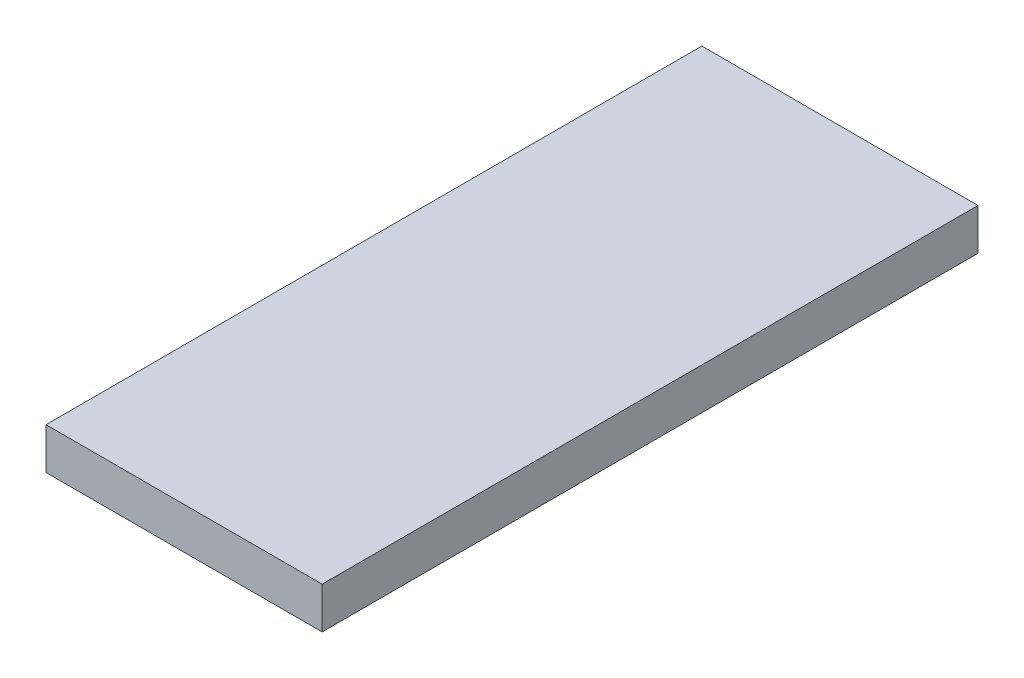
from build123d import *

# Parameters (mm, degrees)
SKETCH1_W           = 16
SKETCH1_H           = 38
BOSS_EXTRUDE1_DEPTH = 2.4


with BuildPart() as part:
    # Sketch1 → Boss-Extrude1 (new body)
    with BuildSketch(Plane(origin=(0, 0, 0), x_dir=(1, 0, 0), z_dir=(0, 1, 0))):
        with Locations((8, 19)):
            Rectangle(SKETCH1_W, SKETCH1_H)
    extrude(amount=BOSS_EXTRUDE1_DEPTH)


solid = part.part
